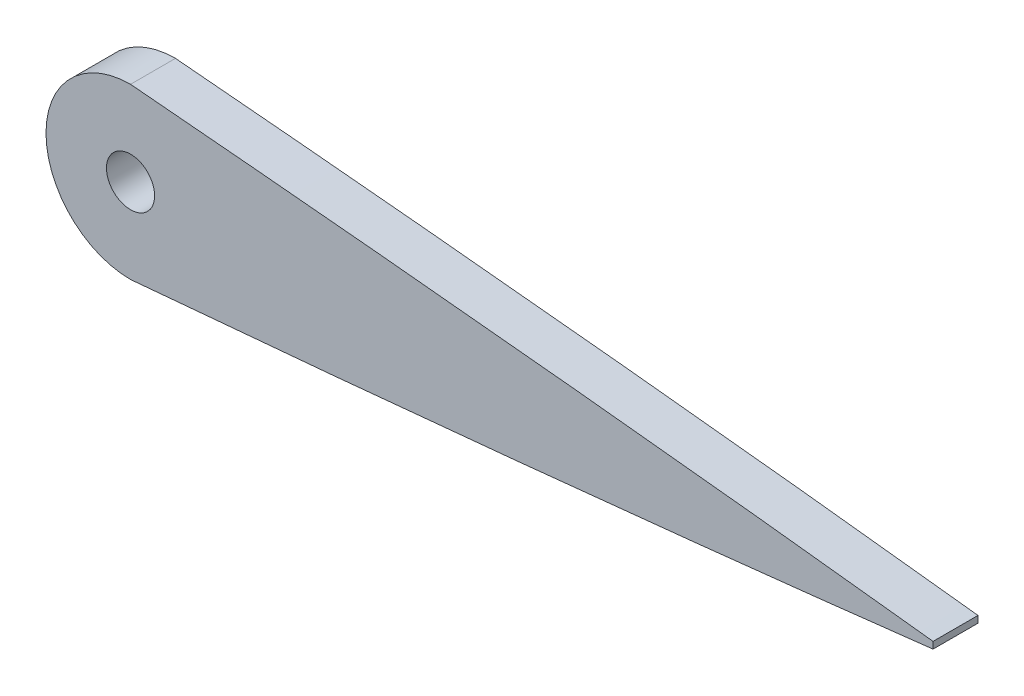
from build123d import *

# Parameters (mm, degrees)
SKETCH_3_R      = 1.5
EXTRUDE_1_DEPTH = 1.4


with BuildPart() as part:
    # Эскиз3 → Бобышка-Вытянуть1 (new, symmetric)
    with BuildSketch(Plane.XY):
        with BuildLine():
            Line((200, -0.21), (200, 0.21))
            add(Edge.make_bspline(
                [(200, 0.21), (199.520051416, 0.265971644), (198.179524953, 0.422303954), (195.747560944, 0.701689979), (192.530784687, 1.065063842), (188.771568451, 1.480695182), (184.58704572, 1.932479181), (180.05616868, 2.409243063), (175.238405485, 2.90257428), (168.371896377, 3.585728287), (161.260104983, 4.261418012), (154.510064634, 4.872380257), (151.327214442, 5.152043902), (150, 5.267185398)],
                knots=[0, 0, 0, 0, 0.007144724, 0.019955661, 0.036196061, 0.055011184, 0.075878938, 0.098428866, 0.122375554, 0.147487885, 0.200459747, 0.22800517, 0.247703369, 0.247703369, 0.247703369, 0.247703369], degree=3))
            ThreePointArc((150, 5.267185398), (144.732814602, 0), (150, -5.267185398))
            add(Edge.make_bspline(
                [(150, -5.267185398), (151.327214442, -5.152043902), (154.510064634, -4.872380257), (161.260104983, -4.261418012), (168.371896377, -3.585728287), (175.238405485, -2.90257428), (180.05616868, -2.409243063), (184.58704572, -1.932479181), (188.771568451, -1.480695182), (192.530784687, -1.065063842), (195.747560944, -0.701689979), (198.179524953, -0.422303954), (199.520051416, -0.265971644), (200, -0.21)],
                knots=[0.752296631, 0.752296631, 0.752296631, 0.752296631, 0.77199483, 0.799540253, 0.852512115, 0.877624446, 0.901571134, 0.924121062, 0.944988816, 0.963803939, 0.980044339, 0.992855276, 1, 1, 1, 1], degree=3))
        make_face()
        with Locations((150, 0)):
            Circle(SKETCH_3_R, mode=Mode.SUBTRACT)
    extrude(amount=EXTRUDE_1_DEPTH, both=True)


solid = part.part
